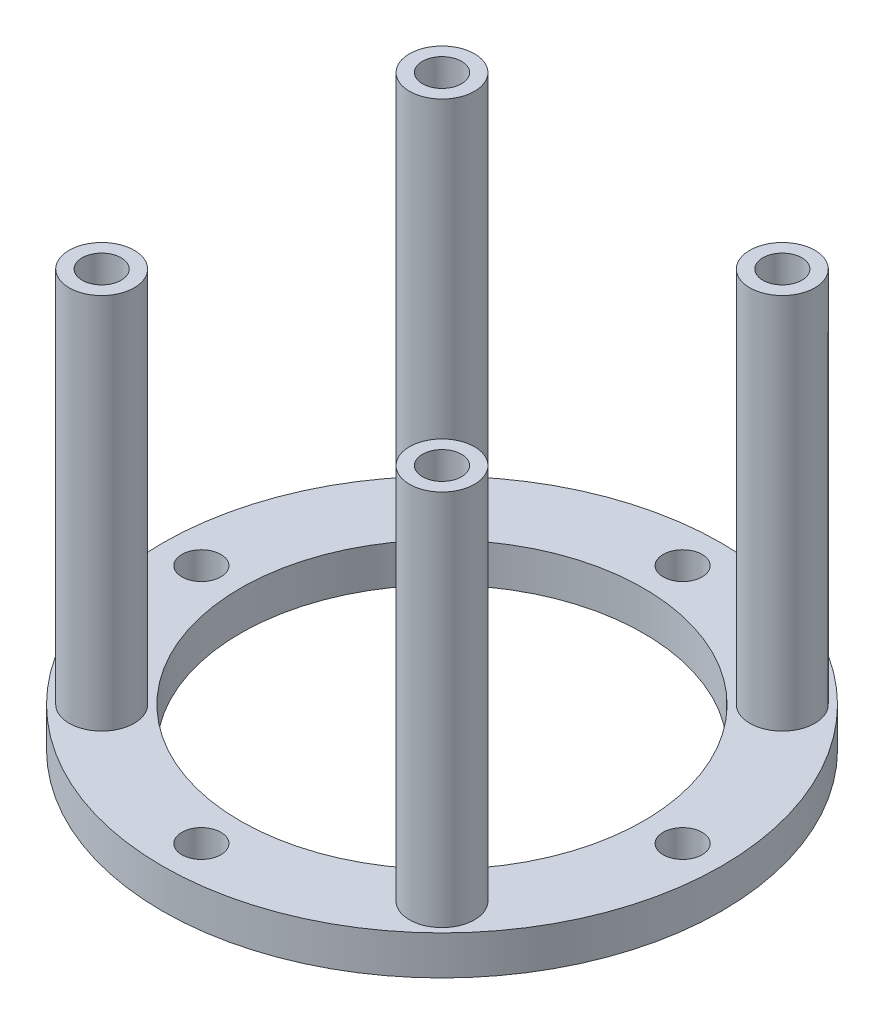
from build123d import *

# Parameters (mm, degrees)
SKETCH1_R           = 21.5
SKETCH1_R_2         = 15.5
SKETCH1_R_3         = 1.5
BOSS_EXTRUDE1_DEPTH = 3
SKETCH2_R           = 2.5
BOSS_EXTRUDE2_DEPTH = 29
SKETCH3_R           = 1.5
CUT_EXTRUDE1_DEPTH  = 5


with BuildPart() as part:
    # Sketch1 → Boss-Extrude1 (new body)
    with BuildSketch(Plane(origin=(0, 0, 0), x_dir=(1, 0, 0), z_dir=(0, 1, 0))):
        with Locations(Location((0, 0, 0), (0, 0, 270))):
            Circle(SKETCH1_R)
        with Locations(Location((0, 0, 0), (0, 0, 270))):
            Circle(SKETCH1_R_2, mode=Mode.SUBTRACT)
        with Locations(Location((0, 18.5, 0), (0, 0, 270))):
            Circle(SKETCH1_R_3, mode=Mode.SUBTRACT)
        with Locations(Location((18.5, 0, 0), (0, 0, 270))):
            Circle(SKETCH1_R_3, mode=Mode.SUBTRACT)
        with Locations(Location((0, -18.5, 0), (0, 0, 270))):
            Circle(SKETCH1_R_3, mode=Mode.SUBTRACT)
        with Locations(Location((-18.5, 0, 0), (0, 0, 270))):
            Circle(SKETCH1_R_3, mode=Mode.SUBTRACT)
    extrude(amount=BOSS_EXTRUDE1_DEPTH)

    # Sketch2 → Boss-Extrude2 (add)
    with BuildSketch(Plane(origin=(0, 3, 0), x_dir=(1, 0, 0), z_dir=(0, 1, 0))):
        with Locations(Location((-13.081475452, 13.081475452, 0), (0, 0, 90))):
            Circle(SKETCH2_R)
        with Locations(Location((13.081475452, 13.081475452, 0), (0, 0, 90))):
            Circle(SKETCH2_R)
        with Locations(Location((13.081475452, -13.081475452, 0), (0, 0, 90))):
            Circle(SKETCH2_R)
        with Locations(Location((-13.081475452, -13.081475452, 0), (0, 0, 90))):
            Circle(SKETCH2_R)
    extrude(amount=BOSS_EXTRUDE2_DEPTH)

    # Sketch3 → Cut-Extrude1 (cut)
    with BuildSketch(Plane(origin=(0, 32, 0), x_dir=(1, 0, 0), z_dir=(0, 1, 0))):
        with Locations(Location((-13.081475452, 13.081475452, 0), (0, 0, 270))):
            Circle(SKETCH3_R)
        with Locations(Location((13.081475452, 13.081475452, 0), (0, 0, 270))):
            Circle(SKETCH3_R)
        with Locations(Location((13.081475452, -13.081475452, 0), (0, 0, 270))):
            Circle(SKETCH3_R)
        with Locations(Location((-13.081475452, -13.081475452, 0), (0, 0, 270))):
            Circle(SKETCH3_R)
    extrude(amount=-CUT_EXTRUDE1_DEPTH, mode=Mode.SUBTRACT)


solid = part.part
